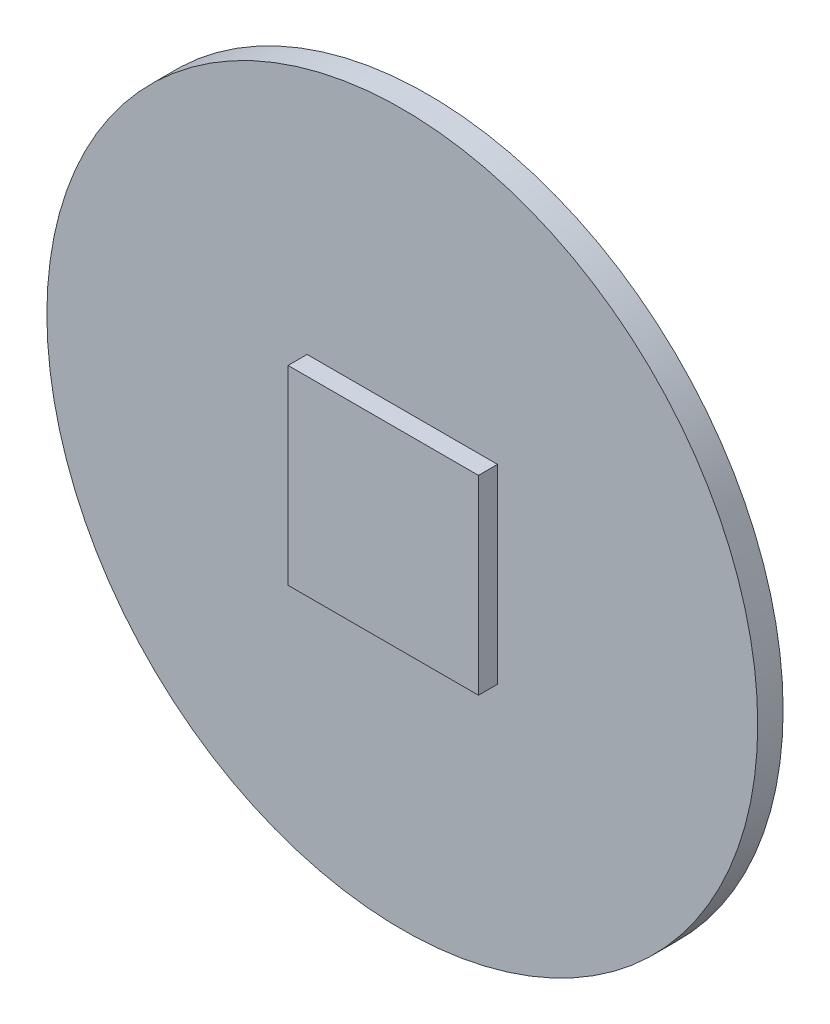
from build123d import *

# Parameters (mm, degrees)
SKETCH_1_R      = 28
EXTRUDE_1_DEPTH = 2
SKETCH_2_W      = 15
SKETCH_2_H      = 15
EXTRUDE_2_DEPTH = 1.5
SKETCH_4_W      = 10
SKETCH_4_H      = 20
EXTRUDE_3_DEPTH = 1.5
SKETCH_5_W      = 15
SKETCH_5_H      = 15
EXTRUDE_4_DEPTH = 1.5


with BuildPart() as part:
    # 草图1 → 凸台-拉伸1 (new body)
    with BuildSketch(Plane.XY):
        Circle(SKETCH_1_R)
    extrude(amount=EXTRUDE_1_DEPTH)

    # 草图2 → 凸台-拉伸2 (add)
    with BuildSketch(Plane.XY.offset(2)):
        Rectangle(SKETCH_2_W, SKETCH_2_H)
    extrude(amount=EXTRUDE_2_DEPTH)

    # 草图4 → 凸台-拉伸3 (add)
    with BuildSketch(Plane(origin=(0, 0, 0), x_dir=(-1, 0, 0), z_dir=(0, 0, -1))):
        with Locations((19, 0)):
            Rectangle(SKETCH_4_W, SKETCH_4_H)
    extrude(amount=EXTRUDE_3_DEPTH)

    # 草图5 → 凸台-拉伸4 (add)
    with BuildSketch(Plane(origin=(0, 0, 0), x_dir=(-1, 0, 0), z_dir=(0, 0, -1))):
        Rectangle(SKETCH_5_W, SKETCH_5_H)
    extrude(amount=EXTRUDE_4_DEPTH)


solid = part.part
